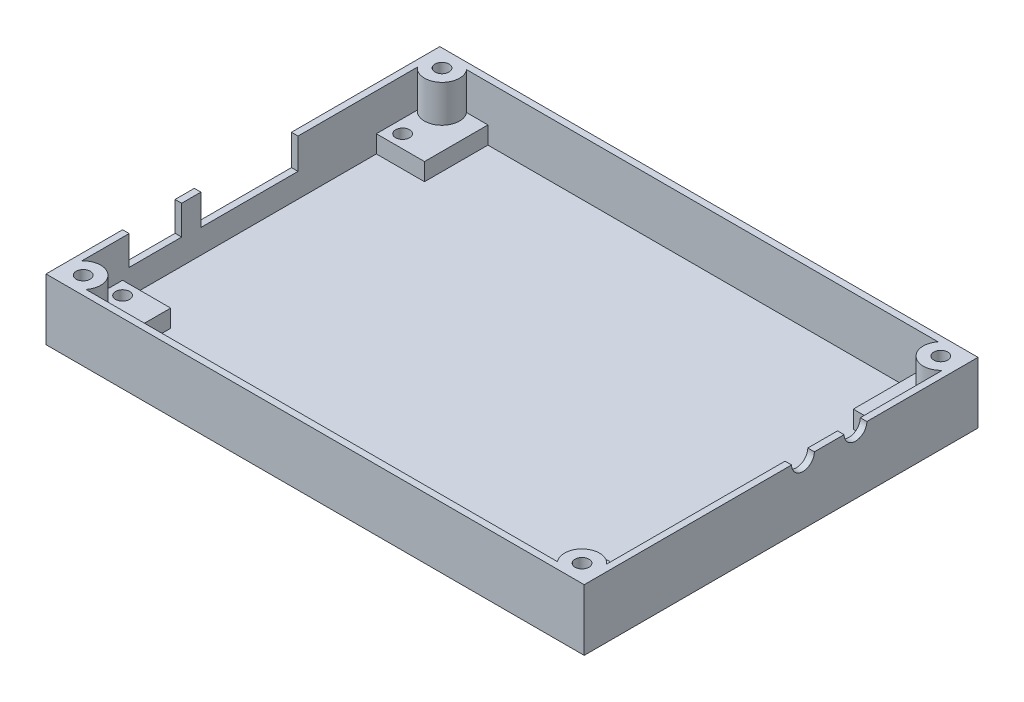
from build123d import *

# Parameters (mm, degrees)
SKETCH_1_W          = 123
SKETCH_1_H          = 90
EXTRUDE_1_DEPTH     = 14
SKETCH_2_W          = 120
SKETCH_2_H          = 87
CUT_EXTRUDE_1_DEPTH = 12.5
SKETCH_3_W          = 12.5
SKETCH_3_H          = 16
EXTRUDE_2_DEPTH     = 4
SKETCH_4_R          = 4
EXTRUDE_3_DEPTH     = 8.5
SKETCH_5_R          = 3
CUT_EXTRUDE_2_DEPTH = 3
SKETCH_6_R          = 1.6
CUT_EXTRUDE_3_DEPTH = 11
SKETCH_7_R          = 2.6
CUT_EXTRUDE_4_DEPTH = 1.5
SKETCH_8_W          = 22.2
SKETCH_8_H          = 7
SKETCH_8_W_2        = 12
SKETCH_8_H_2        = 6.7
CUT_EXTRUDE_5_DEPTH = 1.5
SKETCH_9_R          = 1.6
CUT_EXTRUDE_6_DEPTH = 4


with BuildPart() as part:
    # Эскиз1 → Бобышка-Вытянуть1 (new body)
    with BuildSketch(Plane(origin=(0, 0, 0), x_dir=(1, 0, 0), z_dir=(0, 1, 0))):
        Rectangle(SKETCH_1_W, SKETCH_1_H)
    extrude(amount=EXTRUDE_1_DEPTH)

    # Эскиз2 → Вырез-Вытянуть1 (cut)
    with BuildSketch(Plane(origin=(0, 14, 0), x_dir=(1, 0, 0), z_dir=(0, 1, 0))):
        Rectangle(SKETCH_2_W, SKETCH_2_H)
    extrude(amount=-CUT_EXTRUDE_1_DEPTH, mode=Mode.SUBTRACT)

    # Эскиз3 → Бобышка-Вытянуть2 (add)
    with BuildSketch(Plane(origin=(0, 1.5, 0), x_dir=(1, 0, 0), z_dir=(0, 1, 0))):
        with Locations((-55.25, 37)):
            Rectangle(SKETCH_3_W, SKETCH_3_H)
        with Locations((55.25, 37)):
            Rectangle(SKETCH_3_W, SKETCH_3_H)
        with Locations((55.25, -37)):
            Rectangle(SKETCH_3_W, SKETCH_3_H)
        with Locations((-55.25, -37)):
            Rectangle(SKETCH_3_W, SKETCH_3_H)
    extrude(amount=EXTRUDE_2_DEPTH)

    # Эскиз4 → Бобышка-Вытянуть3 (add)
    with BuildSketch(Plane(origin=(0, 5.5, 0), x_dir=(1, 0, 0), z_dir=(0, 1, 0))):
        with Locations((-57, 41)):
            Circle(SKETCH_4_R)
        with Locations((57, 41)):
            Circle(SKETCH_4_R)
        with Locations((57, -41)):
            Circle(SKETCH_4_R)
        with Locations((-57, -41)):
            Circle(SKETCH_4_R)
    extrude(amount=EXTRUDE_3_DEPTH)

    # Эскиз5 → Вырез-Вытянуть2 (cut)
    with BuildSketch(Plane(origin=(0, 0, 0), x_dir=(1, 0, 0), z_dir=(0, 1, 0))):
        with Locations(Location((-57, 41, 0), (0, 0, 270))):
            Circle(SKETCH_5_R)
        with Locations(Location((57, 41, 0), (0, 0, 270))):
            Circle(SKETCH_5_R)
        with Locations(Location((57, -41, 0), (0, 0, 270))):
            Circle(SKETCH_5_R)
        with Locations(Location((-57, -41, 0), (0, 0, 270))):
            Circle(SKETCH_5_R)
    extrude(amount=CUT_EXTRUDE_2_DEPTH, mode=Mode.SUBTRACT)

    # Эскиз6 → Вырез-Вытянуть3 (cut)
    with BuildSketch(Plane(origin=(0, 14, 0), x_dir=(1, 0, 0), z_dir=(0, 1, 0))):
        with Locations(Location((-57, 41, 0), (0, 0, 270))):
            Circle(SKETCH_6_R)
        with Locations(Location((57, 41, 0), (0, 0, 270))):
            Circle(SKETCH_6_R)
        with Locations(Location((57, -41, 0), (0, 0, 270))):
            Circle(SKETCH_6_R)
        with Locations(Location((-57, -41, 0), (0, 0, 270))):
            Circle(SKETCH_6_R)
    extrude(amount=-CUT_EXTRUDE_3_DEPTH, mode=Mode.SUBTRACT)

    # Эскиз7 → Вырез-Вытянуть4 (cut)
    with BuildSketch(Plane(origin=(61.5, 0, 0), x_dir=(0, 0, -1), z_dir=(1, 0, 0))):
        with Locations((17, 14)):
            Circle(SKETCH_7_R)
        with Locations((5, 14)):
            Circle(SKETCH_7_R)
    extrude(amount=-CUT_EXTRUDE_4_DEPTH, mode=Mode.SUBTRACT)

    # Эскиз8 → Вырез-Вытянуть5 (cut)
    with BuildSketch(Plane.ZY.offset(61.5)):
        with Locations((0, 10.5)):
            Rectangle(SKETCH_8_W, SKETCH_8_H)
        with Locations((21.5, 10.65)):
            Rectangle(SKETCH_8_W_2, SKETCH_8_H_2)
    extrude(amount=-CUT_EXTRUDE_5_DEPTH, mode=Mode.SUBTRACT)

    # Эскиз9 → Вырез-Вытянуть6 (cut)
    with BuildSketch(Plane(origin=(0, 5.5, 0), x_dir=(-1, 0, 0), z_dir=(0, 1, 0))):
        with Locations(Location((57, 32, 0), (0, 0, 90))):
            Circle(SKETCH_9_R)
        with Locations(Location((57, -32, 0), (0, 0, 90))):
            Circle(SKETCH_9_R)
        with Locations(Location((-57, -32, 0), (0, 0, 90))):
            Circle(SKETCH_9_R)
        with Locations(Location((-57, 32, 0), (0, 0, 90))):
            Circle(SKETCH_9_R)
    extrude(amount=-CUT_EXTRUDE_6_DEPTH, mode=Mode.SUBTRACT)


solid = part.part
